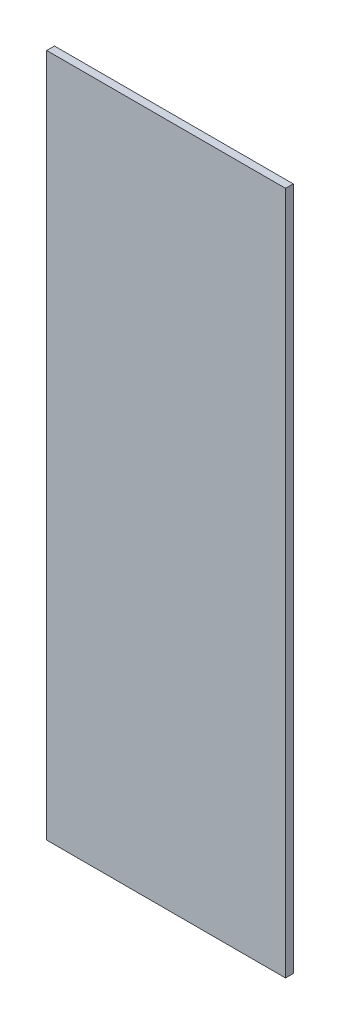
from build123d import *

# Parameters (mm, degrees)
TOPPING_PU_ARKA_1_START = -798.5
SKETCH1_W               = 617
SKETCH1_H               = 1767
TOPPING_PU_ARKA_1_DEPTH = 20


with BuildPart() as part:
    # Sketch1 → TOPPING_pu_arka_1 (new body)
    with BuildSketch(Plane.XY.offset(TOPPING_PU_ARKA_1_START)):
        with Locations((350, 1085)):
            Rectangle(SKETCH1_W, SKETCH1_H)
    extrude(amount=-TOPPING_PU_ARKA_1_DEPTH)


solid = part.part
